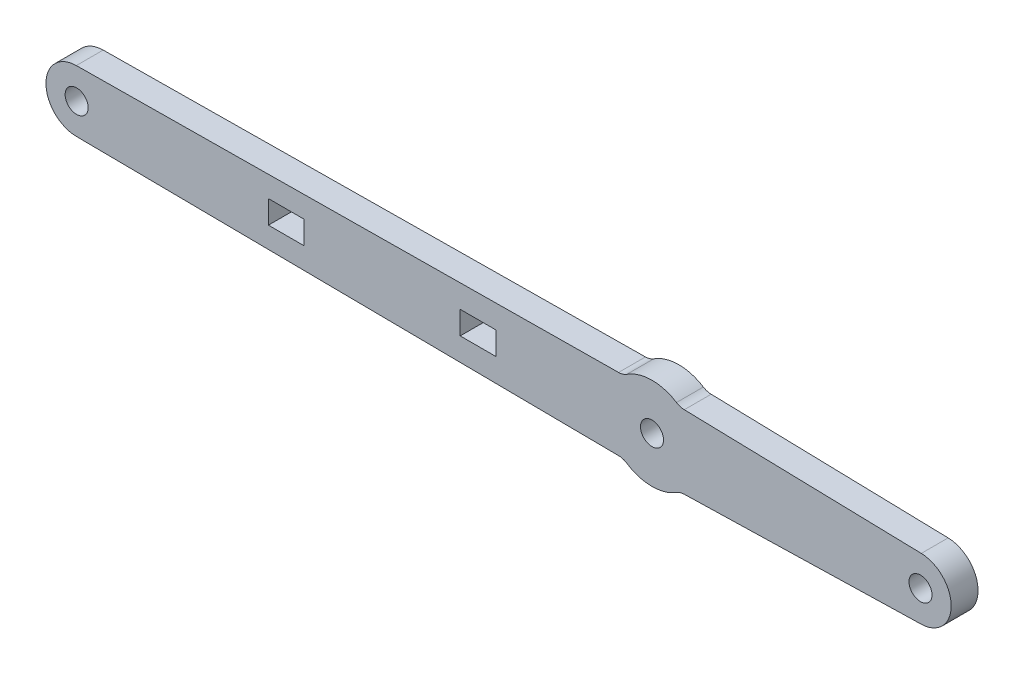
from build123d import *

# Parameters (mm, degrees)
SKETCH1_R           = 1.5
SKETCH1_W           = 4.635083662
SKETCH1_H           = 3
BOSS_EXTRUDE1_DEPTH = 3.5
FILLET1_R           = 2


with BuildPart() as part:
    # Sketch1 → Boss-Extrude1 (new body)
    with BuildSketch(Plane.XY):
        with BuildLine():
            Line((-75.039443802, 3.999805519), (-3.725751189, 4.703060501))
            ThreePointArc((-3.725751189, 4.703060501), (-0.06893841, 5.999603945), (3.616700782, 4.787428898))
            Line((3.616700782, 4.787428898), (35.100171426, 3.998745514))
            ThreePointArc((35.100171426, 3.998745514), (39, 0), (35.100171426, -3.998745514))
            Line((35.100171426, -3.998745514), (3.616700782, -4.787428898))
            ThreePointArc((3.616700782, -4.787428898), (-0.06893841, -5.999603945), (-3.725751189, -4.703060501))
            Line((-3.725751189, -4.703060501), (-75.039443802, -3.999805519))
            ThreePointArc((-75.039443802, -3.999805519), (-79, 0), (-75.039443802, 3.999805519))
        make_face()
        with Locations((-75, 0)):
            Circle(SKETCH1_R, mode=Mode.SUBTRACT)
        Circle(SKETCH1_R, mode=Mode.SUBTRACT)
        with Locations((35, 0)):
            Circle(SKETCH1_R, mode=Mode.SUBTRACT)
        with Locations((-22.682458169, 0)):
            Rectangle(SKETCH1_W, SKETCH1_H, mode=Mode.SUBTRACT)
        with Locations((-47.682458169, 0)):
            Rectangle(SKETCH1_W, SKETCH1_H, mode=Mode.SUBTRACT)
    extrude(amount=BOSS_EXTRUDE1_DEPTH)

    # Fillet1
    fillet1_edges = [part.edges().sort_by_distance(p)[0] for p in [
        (-3.725751189, 4.703060501, 1.75),
        (3.616700782, 4.787428898, 1.75),
        (3.616700782, -4.787428898, 1.75),
        (-3.725751189, -4.703060501, 1.75),
    ]]
    fillet(fillet1_edges, radius=FILLET1_R)


solid = part.part
